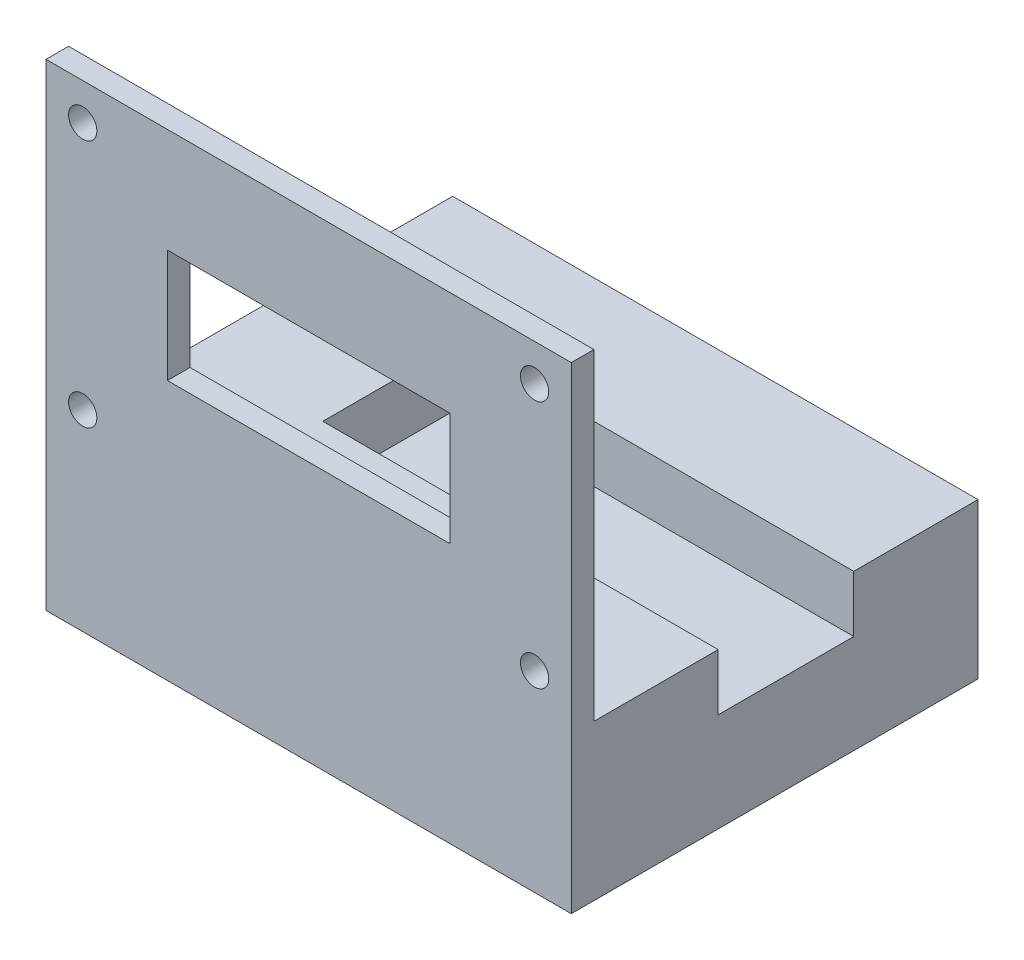
from build123d import *

# Parameters (mm, degrees)
SKETCH1_W           = 46.5
SKETCH1_H           = 34
BOSS_EXTRUDE1_DEPTH = 13.75
SKETCH2_W           = 46.5
SKETCH2_H           = 42.25
BOSS_EXTRUDE2_DEPTH = 2
CUT_EXTRUDE1_REACH  = 62.18
SKETCH3_R           = 1.25
SKETCH3_W           = 25
SKETCH3_H           = 10
SKETCH4_W           = 35
SKETCH4_H           = 12
CUT_EXTRUDE2_DEPTH  = 5
SKETCH6_R           = 2
CUT_EXTRUDE3_DEPTH  = 10


with BuildPart() as part:
    # Sketch1 → Boss-Extrude1 (new body)
    with BuildSketch(Plane(origin=(0, 0, 0), x_dir=(1, 0, 0), z_dir=(0, 1, 0))):
        Rectangle(SKETCH1_W, SKETCH1_H)
    extrude(amount=BOSS_EXTRUDE1_DEPTH)

    # Sketch2 → Boss-Extrude2 (add)
    with BuildSketch(Plane.XY.offset(17)):
        with Locations((0, 21.125)):
            Rectangle(SKETCH2_W, SKETCH2_H)
    extrude(amount=BOSS_EXTRUDE2_DEPTH)

    # Sketch3 → Cut-Extrude1 (cut, up to next)
    with BuildSketch(Plane.XY.offset(19), mode=Mode.PRIVATE) as cut_extrude1_sk1:
        with Locations((-20, 39)):
            Circle(SKETCH3_R)
    cut_extrude1_tool1 = extrude(cut_extrude1_sk1.sketch, amount=-CUT_EXTRUDE1_REACH, mode=Mode.PRIVATE) & part.part
    # Sketch3 → Cut-Extrude1 (cut, up to next)
    with BuildSketch(Plane.XY.offset(19), mode=Mode.PRIVATE) as cut_extrude1_sk2:
        with Locations(Location((20, 39, 0), (0, 0, 180))):
            Circle(SKETCH3_R)
    cut_extrude1_tool2 = extrude(cut_extrude1_sk2.sketch, amount=-CUT_EXTRUDE1_REACH, mode=Mode.PRIVATE) & part.part
    # Sketch3 → Cut-Extrude1 (cut, up to next)
    with BuildSketch(Plane.XY.offset(19), mode=Mode.PRIVATE) as cut_extrude1_sk3:
        with Locations((20, 17)):
            Circle(SKETCH3_R)
    cut_extrude1_tool3 = extrude(cut_extrude1_sk3.sketch, amount=-CUT_EXTRUDE1_REACH, mode=Mode.PRIVATE) & part.part
    # Sketch3 → Cut-Extrude1 (cut, up to next)
    with BuildSketch(Plane.XY.offset(19), mode=Mode.PRIVATE) as cut_extrude1_sk4:
        with Locations(Location((-20, 17, 0), (0, 0, 180))):
            Circle(SKETCH3_R)
    cut_extrude1_tool4 = extrude(cut_extrude1_sk4.sketch, amount=-CUT_EXTRUDE1_REACH, mode=Mode.PRIVATE) & part.part
    # Sketch3 → Cut-Extrude1 (cut, up to next)
    with BuildSketch(Plane.XY.offset(19), mode=Mode.PRIVATE) as cut_extrude1_sk5:
        with Locations((0, 28)):
            Rectangle(SKETCH3_W, SKETCH3_H)
    cut_extrude1_tool5 = extrude(cut_extrude1_sk5.sketch, amount=-CUT_EXTRUDE1_REACH, mode=Mode.PRIVATE) & part.part
    add(cut_extrude1_tool1.solids().sort_by_distance((-20, 39, 19))[0], mode=Mode.SUBTRACT)
    add(cut_extrude1_tool2.solids().sort_by_distance((20, 39, 19))[0], mode=Mode.SUBTRACT)
    add(cut_extrude1_tool3.solids().sort_by_distance((20, 17, 19))[0], mode=Mode.SUBTRACT)
    add(cut_extrude1_tool4.solids().sort_by_distance((-20, 17, 19))[0], mode=Mode.SUBTRACT)
    add(cut_extrude1_tool5.solids().sort_by_distance((0, 28, 19))[0], mode=Mode.SUBTRACT)

    # Sketch4 → Cut-Extrude2 (cut)
    with BuildSketch(Plane(origin=(0, 13.75, 0), x_dir=(1, 0, 0), z_dir=(0, 1, 0))):
        with Locations((5.75, 0)):
            Rectangle(SKETCH4_W, SKETCH4_H)
    extrude(amount=-CUT_EXTRUDE2_DEPTH, mode=Mode.SUBTRACT)

    # Sketch6 → Cut-Extrude3 (cut)
    with BuildSketch(Plane.XZ):
        with Locations(Location((16.25, -10, 0), (0, 0, 270))):
            Circle(SKETCH6_R)
        with Locations(Location((16.25, 12, 0), (0, 0, 270))):
            Circle(SKETCH6_R)
        with Locations(Location((-16.25, -10, 0), (0, 0, 270))):
            Circle(SKETCH6_R)
        with Locations(Location((-16.25, 12, 0), (0, 0, 270))):
            Circle(SKETCH6_R)
    extrude(amount=-CUT_EXTRUDE3_DEPTH, mode=Mode.SUBTRACT)


solid = part.part
